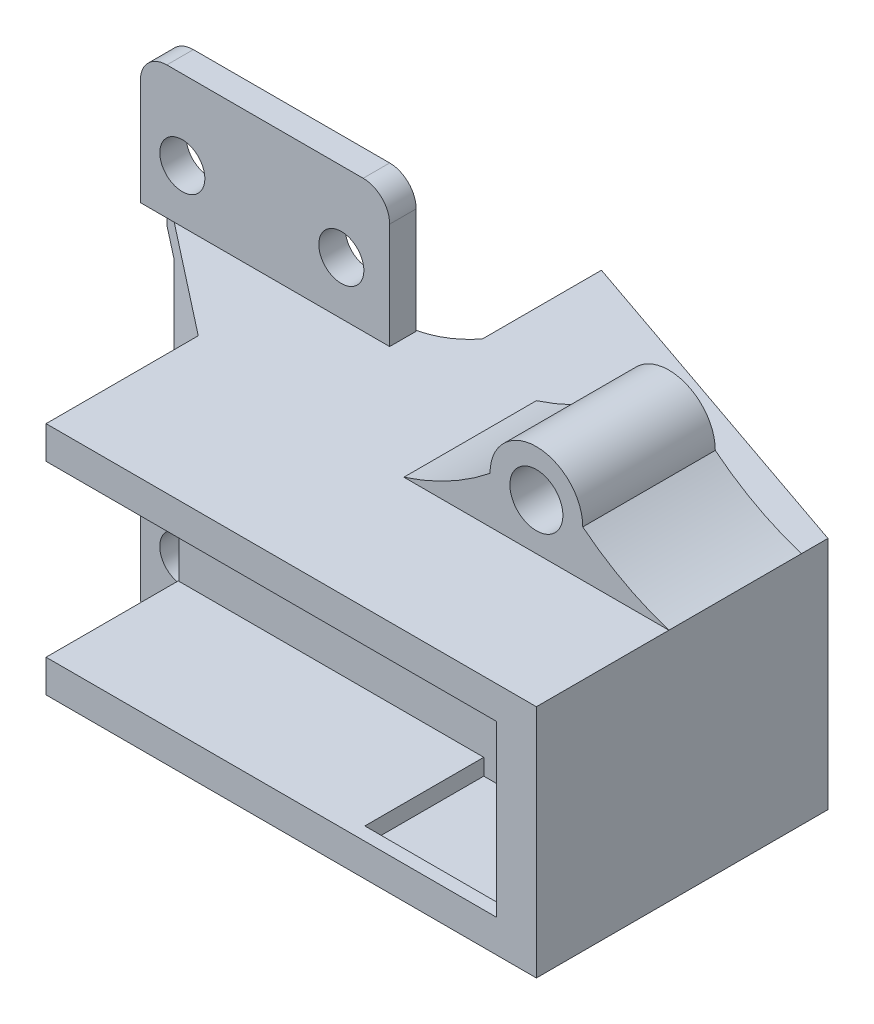
from build123d import *
from build123d.topology import SkipClean

# Parameters (mm, degrees)
SALIENTE_EXTRUIR2_DEPTH      = 20
SALIENTE_EXTRUIR3_START      = -2.463797
SALIENTE_EXTRUIR3_DEPTH      = 2.463797
SALIENTE_EXTRUIR4_DEPTH      = 2.463797195
CROQUIS4_R                   = 2
CROQUIS4_R_2                 = 3.5
SALIENTE_EXTRUIR5_DEPTH      = 10
CORTAR_EXTRUIR1_DEPTH        = 10
CORTAR_EXTRUIR1_DEPTH_BACK   = 19
CROQUIS5_W                   = 10.904508264
CROQUIS5_H                   = 15.264086628
SALIENTE_EXTRUIR6_DEPTH      = 9.255106
SALIENTE_EXTRUIR6_DEPTH_BACK = 10.025
CROQUIS7_W                   = 23.956346688
CROQUIS7_H                   = 15.277003438
CORTAR_EXTRUIR2_DEPTH        = 103.636657602
CROQUIS9_W                   = 4
CROQUIS9_H                   = 12.8
CORTAR_EXTRUIR3_DEPTH        = 44.32026299
SALIENTE_EXTRUIR14_DEPTH     = 17.727594
CROQUIS11_R                  = 1.7
SALIENTE_EXTRUIR15_DEPTH     = 2
SALIENTE_EXTRUIR16_DEPTH     = 12.8


with BuildPart() as part:
    # Croquis1 → Saliente-Extruir2 (new body)
    with BuildSketch(Plane.XY):
        Polygon((60.885724234, -9.113797195), (97.885724234, -9.113797195), (97.885724234, 8.613797195), (60.885724234, 8.613797195), (60.885724234, 6.15), (94.885724234, 6.15), (94.885724234, -6.65), (60.885724234, -6.65), align=None)
    extrude(amount=SALIENTE_EXTRUIR2_DEPTH)

    # Croquis2 → Saliente-Extruir3 (add)
    with SkipClean():  # the faces are left unmerged after this step: merging them gives an invalid solid
        with BuildSketch(Plane(origin=(0, 8.613797195, 0), x_dir=(1, 0, 0), z_dir=(0, 1, 0)).offset(SALIENTE_EXTRUIR3_START)):
            with BuildLine():
                ThreePointArc((71.814275766, 2), (70.308416296, 0.672909982), (68.417392018, 0))
                Line((68.417392018, 0), (97.885724234, 0))
                Line((97.885724234, 0), (71.814275766, 9.255105503))
                Line((71.814275766, 9.255105503), (71.814275766, 2))
            make_face()
            Polygon((50.000330077, 0), (60.885724234, -8.516201314), (60.885724234, 0), align=None)
        extrude(amount=SALIENTE_EXTRUIR3_DEPTH)

    # Croquis3 → Saliente-Extruir4 (add)
    with SkipClean():  # the faces are left unmerged after this step: merging them gives an invalid solid
        with BuildSketch(Plane.XZ.offset(9.113797195)):
            Polygon((60.885724234, 0), (60.885724234, 8.516201314), (50.000330077, 0), align=None)
            with BuildLine():
                Line((94.885724234, 0), (68.417392018, 0))
                ThreePointArc((68.417392018, 0), (70.308416296, -0.672909982), (71.814275766, -2))
                Line((71.814275766, -2), (71.814275766, -9.255105503))
                Line((71.814275766, -9.255105503), (97.885724234, 0))
                Line((97.885724234, 0), (94.885724234, 0))
            make_face()
        extrude(amount=-SALIENTE_EXTRUIR4_DEPTH)

    # Croquis4 → Saliente-Extruir5 (add)
    # profile 1 of 4: a face of its own
    with SkipClean():  # the faces are left unmerged after this step: merging them gives an invalid solid
        with BuildSketch(Plane(origin=(0, 0, 0), x_dir=(-1, 0, 0), z_dir=(0, 0, -1))):
            with BuildLine():
                ThreePointArc((-84.385724234, 12.113797195), (-81.296227313, 10.065720048), (-77.885724234, 8.613797195))
                Line((-77.885724234, 8.613797195), (-97.885724234, 8.613797195))
                ThreePointArc((-97.885724234, 8.613797195), (-94.475221154, 10.065720048), (-91.385724234, 12.113797195))
                ThreePointArc((-91.385724234, 12.113797195), (-87.885724234, 15.613797195), (-84.385724234, 12.113797195))
            make_face()
            with Locations((-87.885724234, 12.113797195)):
                Circle(CROQUIS4_R, mode=Mode.SUBTRACT)
        # profile 2 of 4: a face of its own
        with BuildSketch(Plane(origin=(0, 0, 0), x_dir=(-1, 0, 0), z_dir=(0, 0, -1))):
            with BuildLine():
                ThreePointArc((-91.385724234, -12.613797195), (-90.360597982, -10.138923475), (-87.885724275, -9.113797195))
                Line((-87.885724275, -9.113797195), (-97.885724234, -9.113797195))
                ThreePointArc((-97.885724234, -9.113797195), (-94.475221154, -10.565720048), (-91.385724234, -12.613797195))
            make_face()
        # profile 3 of 4: a face of its own
        with BuildSketch(Plane(origin=(0, 0, 0), x_dir=(-1, 0, 0), z_dir=(0, 0, -1))):
            with BuildLine():
                ThreePointArc((-84.385724234, -12.613797195), (-81.296227313, -10.565720048), (-77.885724234, -9.113797195))
                Line((-77.885724234, -9.113797195), (-87.885724275, -9.113797195))
                ThreePointArc((-87.885724275, -9.113797195), (-85.410850514, -10.138923446), (-84.385724234, -12.613797195))
            make_face()
        # profile 4 of 4: a face of its own
        with BuildSketch(Plane(origin=(0, 0, 0), x_dir=(-1, 0, 0), z_dir=(0, 0, -1))):
            with Locations((-87.885724234, -12.613797195)):
                Circle(CROQUIS4_R_2)
            with Locations((-87.885724234, -12.613797195)):
                Circle(CROQUIS4_R, mode=Mode.SUBTRACT)
        extrude(amount=-SALIENTE_EXTRUIR5_DEPTH)

    # Croquis5 → Cortar-Extruir1 (cut, two sides: drawn at the far end of the back side and taken through both)
    with SkipClean():  # the faces are left unmerged after this step: merging them gives an invalid solid
        with BuildSketch(Plane(origin=(0, 0, 0), x_dir=(-1, 0, 0), z_dir=(0, 0, -1)).offset(-CORTAR_EXTRUIR1_DEPTH_BACK)):
            with Locations((-89.39295043, -0.250144717)):
                Rectangle(CROQUIS5_W, CROQUIS5_H)
        extrude(amount=CORTAR_EXTRUIR1_DEPTH + CORTAR_EXTRUIR1_DEPTH_BACK, mode=Mode.SUBTRACT)

    # Croquis7 → Saliente-Extruir6 (add, two sides: drawn at the far end of the back side and taken through both)
    with SkipClean():  # the faces are left unmerged after this step: merging them gives an invalid solid
        with BuildSketch(Plane(origin=(0, 0, 0), x_dir=(-1, 0, 0), z_dir=(0, 0, -1)).offset(-SALIENTE_EXTRUIR6_DEPTH_BACK)):
            with Locations((-72.90755089, -0.256603122)):
                Rectangle(CROQUIS7_W, CROQUIS7_H)
        extrude(amount=SALIENTE_EXTRUIR6_DEPTH + SALIENTE_EXTRUIR6_DEPTH_BACK)

    # Croquis8 → Cortar-Extruir2 (cut, through all)
    with SkipClean():  # the faces are left unmerged after this step: merging them gives an invalid solid
        with BuildSketch(Plane.XZ.offset(7.895104841)):
            with BuildLine():
                ThreePointArc((71.814275766, -2), (70.308416296, -0.672909982), (68.417392018, 0))
                Line((68.417392018, 0), (60.929377546, 0))
                Line((60.929377546, 0), (60.929377546, -9.255105503))
                Line((60.929377546, -9.255105503), (71.814275766, -9.255105503))
                Line((71.814275766, -9.255105503), (71.814275766, -2))
            make_face()
            Polygon((84.885724234, -4.614871003), (71.814275766, -9.255105503), (84.885724234, -9.255105503), align=None)
        extrude(amount=-CORTAR_EXTRUIR2_DEPTH, mode=Mode.SUBTRACT)


with BuildPart() as cortar_extruir2_kept_piece:
    # of the separate pieces the step leaves, the one the design keeps (cortar_extruir2_pieces_kept)
    add(part.part.solids().sort_by_distance((60.885724234, -9.113797195, 0))[0])

    # Croquis9 → Cortar-Extruir3 (cut, through all)
    with BuildSketch(Plane(origin=(84.885724234, 0, 0), x_dir=(0, 0, -1), z_dir=(1, 0, 0))):
        with Locations((-2, -0.25)):
            Rectangle(CROQUIS9_W, CROQUIS9_H)
    extrude(amount=-CORTAR_EXTRUIR3_DEPTH, mode=Mode.SUBTRACT)

    # Croquis10 → Saliente-Extruir14 (add)
    with SkipClean():  # the faces are left unmerged after this step: merging them gives an invalid solid
        with BuildSketch(Plane.XZ.offset(9.113797195)):
            Polygon((71.814275766, -9.255105503), (71.814275766, -10.980236396), (97.885724234, -2), (97.885724234, 0), (97.885724234, 0.393932893), (71.814275766, -8.86117261), align=None)
        extrude(amount=-SALIENTE_EXTRUIR14_DEPTH)

    # Croquis11 → Saliente-Extruir15 (add)
    # profile 1 of 2: a face of its own
    with SkipClean():  # the faces are left unmerged after this step: merging them gives an invalid solid
        with BuildSketch(Plane(origin=(0, 0, 0), x_dir=(-1, 0, 0), z_dir=(0, 0, -1))):
            with BuildLine():
                Line((-68.417392018, -9.113797195), (-50.000330077, -9.113797195))
                Line((-50.000330077, -9.113797195), (-50.000330077, -17.113797195))
                ThreePointArc((-50.000330077, -17.113797195), (-50.586116515, -18.528010757), (-52.000330077, -19.113797195))
                Line((-52.000330077, -19.113797195), (-66.417392018, -19.113797195))
                ThreePointArc((-66.417392018, -19.113797195), (-67.831605581, -18.528010757), (-68.417392018, -17.113797195))
                Line((-68.417392018, -17.113797195), (-68.417392018, -9.113797195))
            make_face()
            with Locations(Location((-65.166367035, -13.113797195, 0), (0, 0, 180))):
                Circle(CROQUIS11_R, mode=Mode.SUBTRACT)
            with Locations(Location((-53.166367035, -13.113797195, 0), (0, 0, 180))):
                Circle(CROQUIS11_R, mode=Mode.SUBTRACT)
        # profile 2 of 2: a face of its own
        with BuildSketch(Plane(origin=(0, 0, 0), x_dir=(-1, 0, 0), z_dir=(0, 0, -1))):
            with BuildLine():
                Line((-50.000330077, 8.613797195), (-68.814275766, 8.613797195))
                Line((-68.814275766, 8.613797195), (-68.814275766, 16.613797195))
                ThreePointArc((-68.814275766, 16.613797195), (-68.228489329, 18.028010757), (-66.814275766, 18.613797195))
                Line((-66.814275766, 18.613797195), (-52.000330077, 18.613797195))
                ThreePointArc((-52.000330077, 18.613797195), (-50.586116515, 18.028010757), (-50.000330077, 16.613797195))
                Line((-50.000330077, 16.613797195), (-50.000330077, 8.613797195))
            make_face()
            with Locations((-53.166367035, 12.613797195)):
                Circle(CROQUIS11_R, mode=Mode.SUBTRACT)
            with Locations((-65.166367035, 12.613797195)):
                Circle(CROQUIS11_R, mode=Mode.SUBTRACT)
        extrude(amount=-SALIENTE_EXTRUIR15_DEPTH)

    # Croquis12 → Saliente-Extruir16 (add)
    with SkipClean():  # the faces are left unmerged after this step: merging them gives an invalid solid
        with BuildSketch(Plane(origin=(0, -6.65, 0), x_dir=(1, 0, 0), z_dir=(0, 1, 0))):
            Polygon((60.885724234, -8.516201314), (52.556726704, -2), (55.113123331, -2), (60.885724234, -6.516201314), align=None)
        extrude(amount=SALIENTE_EXTRUIR16_DEPTH)


solid = cortar_extruir2_kept_piece.part
